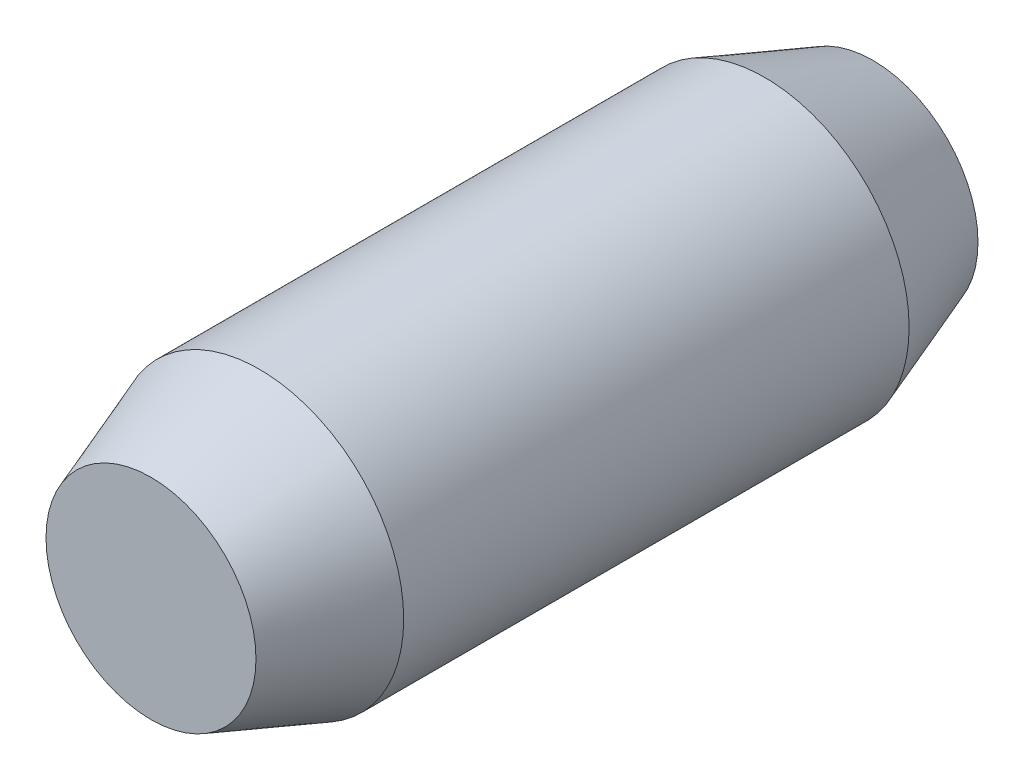
from build123d import *

# Parameters (mm, degrees)
SKETCH1_R      = 4
EXTRUDE1_DEPTH = 20
CHAMFER2_SIZE  = 3
CHAMFER2_SIZE2 = 1.091910703
CHAMFER3_SIZE  = 3
CHAMFER3_SIZE2 = 1.091910703


with BuildPart() as part:
    # Sketch1 → Extrude1 (new body)
    with BuildSketch(Plane.XY):
        Circle(SKETCH1_R)
    extrude(amount=EXTRUDE1_DEPTH)

    # Chamfer2
    chamfer2_edges = [part.edges().sort_by_distance(p)[0] for p in [
        (-4, 0, 20),
    ]]
    chamfer2_side = [part.faces().sort_by_distance(p)[0] for p in [
        (-4, 0, 10),
    ]]
    chamfer(chamfer2_edges, length=CHAMFER2_SIZE, length2=CHAMFER2_SIZE2, reference=chamfer2_side[0])

    # Chamfer3
    chamfer3_edges = [part.edges().sort_by_distance(p)[0] for p in [
        (-4, 0, 0),
    ]]
    chamfer3_side = [part.faces().sort_by_distance(p)[0] for p in [
        (-4, 0, 8.5),
    ]]
    chamfer(chamfer3_edges, length=CHAMFER3_SIZE, length2=CHAMFER3_SIZE2, reference=chamfer3_side[0])


solid = part.part
